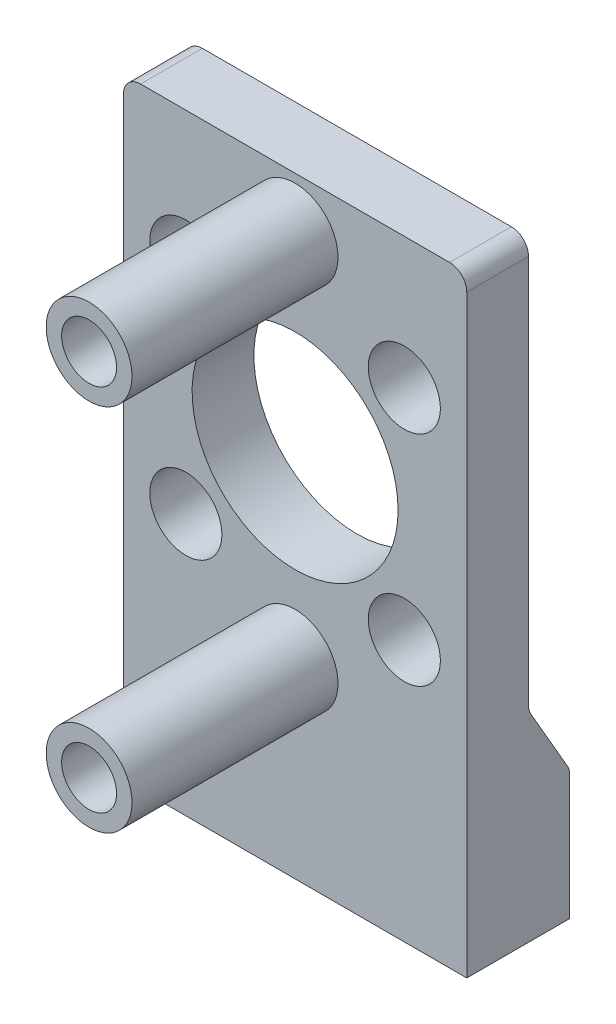
from build123d import *

# Parameters (mm, degrees)
EXTRUDE_1_DEPTH     = 3
SKETCH_2_R          = 0.8
CUT_EXTRUDE_1_DEPTH = 3.5
SKETCH_6_R          = 3
SKETCH_6_R_2        = 1.05
CUT_EXTRUDE_2_DEPTH = 5
FILLET_1_R          = 0.5
CUT_EXTRUDE_4_DEPTH = 15.514169722
FILLET_2_R          = 0.5
SKETCH_13_R         = 1.25
SKETCH_13_R_2       = 0.8
EXTRUDE_2_DEPTH     = 6


with BuildPart() as part:
    # 草图1 → 凸台-拉伸1 (new body)
    with BuildSketch(Plane.XY):
        Polygon((-5, -9.782714055), (-5, -10.082714055), (5, -10.082714055), (5, -4.612414327), (5, 7.717285945), (-5, 7.717285945), align=None)
    extrude(amount=EXTRUDE_1_DEPTH)

    # 草图2 → 切除-拉伸1 (cut)
    with BuildSketch(Plane(origin=(0, -10.082714055, 0), x_dir=(-1, 0, 0), z_dir=(0, -1, 0))):
        with Locations(Location((3, -1.5, 0), (0, 0, 90))):
            Circle(SKETCH_2_R)
        with Locations(Location((-3, -1.5, 0), (0, 0, 270))):
            Circle(SKETCH_2_R)
    extrude(amount=-CUT_EXTRUDE_1_DEPTH, mode=Mode.SUBTRACT)

    # 草图6 → 切除-拉伸2 (cut)
    with BuildSketch(Plane(origin=(0, 0, 0), x_dir=(-1, 0, 0), z_dir=(0, 0, -1))):
        with Locations((0, 0.717285945)):
            Circle(SKETCH_6_R)
        with Locations((-3.181980515, 3.89926646)):
            Circle(SKETCH_6_R_2)
        with Locations((3.181980515, 3.89926646)):
            Circle(SKETCH_6_R_2)
        with Locations((3.181980515, -2.46469457)):
            Circle(SKETCH_6_R_2)
        with Locations((-3.181980515, -2.46469457)):
            Circle(SKETCH_6_R_2)
    extrude(amount=-CUT_EXTRUDE_2_DEPTH, mode=Mode.SUBTRACT)

    # 圆角1
    fillet_1_edges = [part.edges().sort_by_distance(p)[0] for p in [
        (-5, 7.717285945, 1.5),
        (5, 7.717285945, 1.5),
    ]]
    fillet(fillet_1_edges, radius=FILLET_1_R)

    # 草图12 → 切除-拉伸4 (cut, through all)
    with BuildSketch(Plane(origin=(5, 0, 0), x_dir=(0, 0, -1), z_dir=(1, 0, 0))):
        Polygon((-1.2, 7.717285945), (-1.2, -4.243803332), (0, -6.322264301), (0, 7.717285945), align=None)
    extrude(amount=-CUT_EXTRUDE_4_DEPTH, mode=Mode.SUBTRACT)

    # 圆角2
    fillet_2_edges = [part.edges().sort_by_distance(p)[0] for p in [
        (0, -4.243803332, 1.2),
        (0, -6.322264301, 0),
    ]]
    fillet(fillet_2_edges, radius=FILLET_2_R)

    # 草图13 → 凸台-拉伸2 (add)
    # profile 1 of 2: a face of its own
    with BuildSketch(Plane.XY.offset(3)):
        with Locations((0, 6.217285945)):
            Circle(SKETCH_13_R)
        with Locations((0, 6.217285945)):
            Circle(SKETCH_13_R_2, mode=Mode.SUBTRACT)
    # profile 2 of 2: a face of its own
    with BuildSketch(Plane.XY.offset(3)):
        with Locations((0, -4.532714055)):
            Circle(SKETCH_13_R)
        with Locations((0, -4.532714055)):
            Circle(SKETCH_13_R_2, mode=Mode.SUBTRACT)
    extrude(amount=EXTRUDE_2_DEPTH)


solid = part.part
